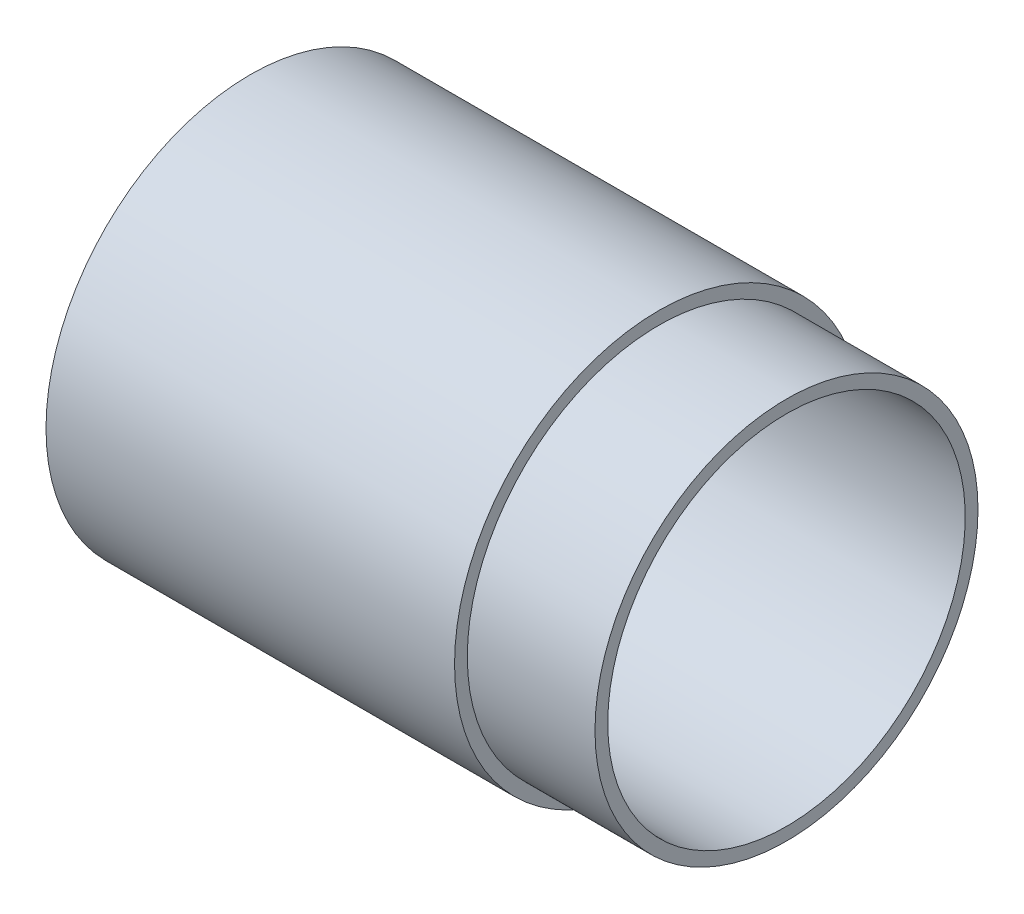
from build123d import *

# Parameters (mm, degrees)
SKIZZE1_W   = 160
SKIZZE1_H   = 5
SKIZZE1_W_2 = 100


with BuildPart() as part:
    # Skizze1 → Rotation1 (revolve)
    with BuildSketch(Plane.XY, mode=Mode.PRIVATE) as rotation1_sk:
        with Locations((80, 77.5)):
            Rectangle(SKIZZE1_W, SKIZZE1_H)
        with Locations((160, 72.5)):
            Rectangle(SKIZZE1_W_2, SKIZZE1_H)
    revolve(rotation1_sk.sketch.rotate(Axis((0, 0, 0), (1, 0, 0)), 90), axis=Axis((0, 0, 0), (1, 0, 0)))


solid = part.part
